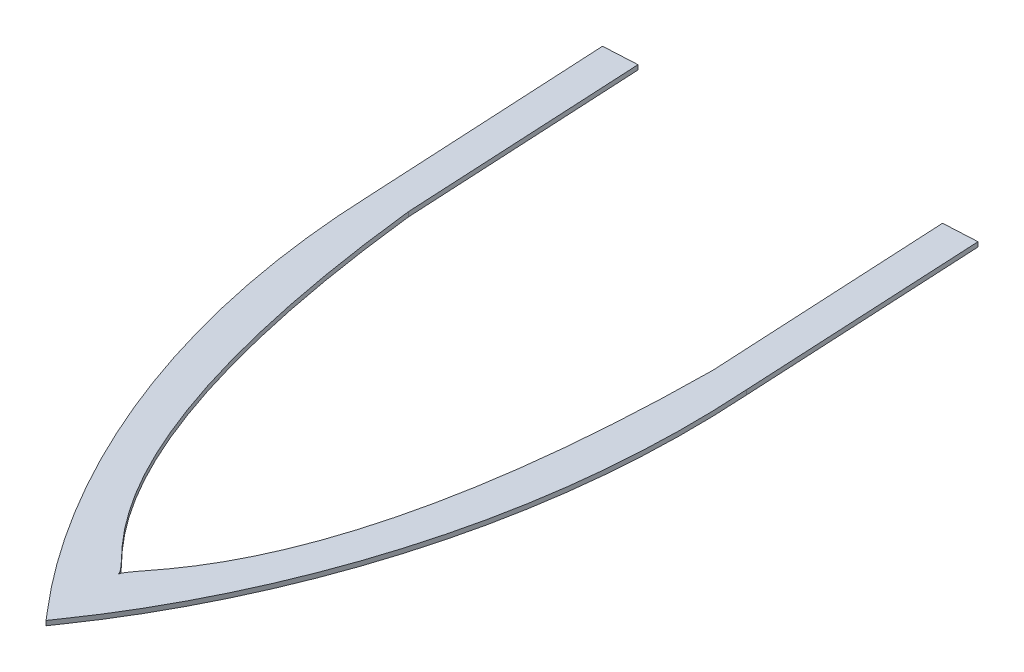
from build123d import *

# Parameters (mm, degrees)
BOSS_EXTRUDE1_DEPTH = 4


with BuildPart() as part:
    # Sketch1 → Boss-Extrude1 (new body)
    with BuildSketch(Plane(origin=(0, 0, 0), x_dir=(1, 0, 0), z_dir=(0, 1, 0))):
        with BuildLine():
            Line((-287.599492609, 307.846688721), (-276.509158993, 96.230517076))
            add(Edge.make_bspline(
                [(-276.509158993, 96.230517076), (-265.498754924, -193.422418568), (-100.154473104, -360.089981136), (-97.455270859, -365.359331923)],
                knots=[0, 0, 0, 0, 1, 1, 1, 1], degree=3))
            Line((-97.455270859, -365.359331923), (-100.871017472, -299.24345381))
            add(Edge.make_bspline(
                [(-247.476970144, 99.184701956), (-209.870171036, -233.687963111), (-103.612719847, -283.411888875), (-100.871017472, -299.24345381)],
                knots=[0, 0, 0, 0, 1, 1, 1, 1], degree=3))
            Line((-247.476970144, 99.184701956), (-258.335189119, 309.358571318))
            Line((-258.335189119, 309.358571318), (-287.599492609, 307.846688721))
        make_face()
        with BuildLine():
            Line((-6.962227222, 322.345260258), (3.895991753, 112.171390896))
            add(Edge.make_bspline(
                [(3.895991753, 112.171390896), (0.792272957, -222.80450289), (-99.775370482, -283.213639779), (-100.871017472, -299.24345381)],
                knots=[0, 0, 0, 0, 1, 1, 1, 1], degree=3))
            Line((-100.871017472, -299.24345381), (-97.455270859, -365.359331923))
            add(Edge.make_bspline(
                [(33.078047071, 112.224730275), (51.975289253, -177.020747413), (-95.313450893, -359.839879259), (-97.455270859, -365.359331923)],
                knots=[0, 0, 0, 0, 1, 1, 1, 1], degree=3))
            Line((33.078047071, 112.224730275), (22.302076268, 323.857142855))
            Line((22.302076268, 323.857142855), (-6.962227222, 322.345260258))
        make_face()
    extrude(amount=BOSS_EXTRUDE1_DEPTH)


solid = part.part
